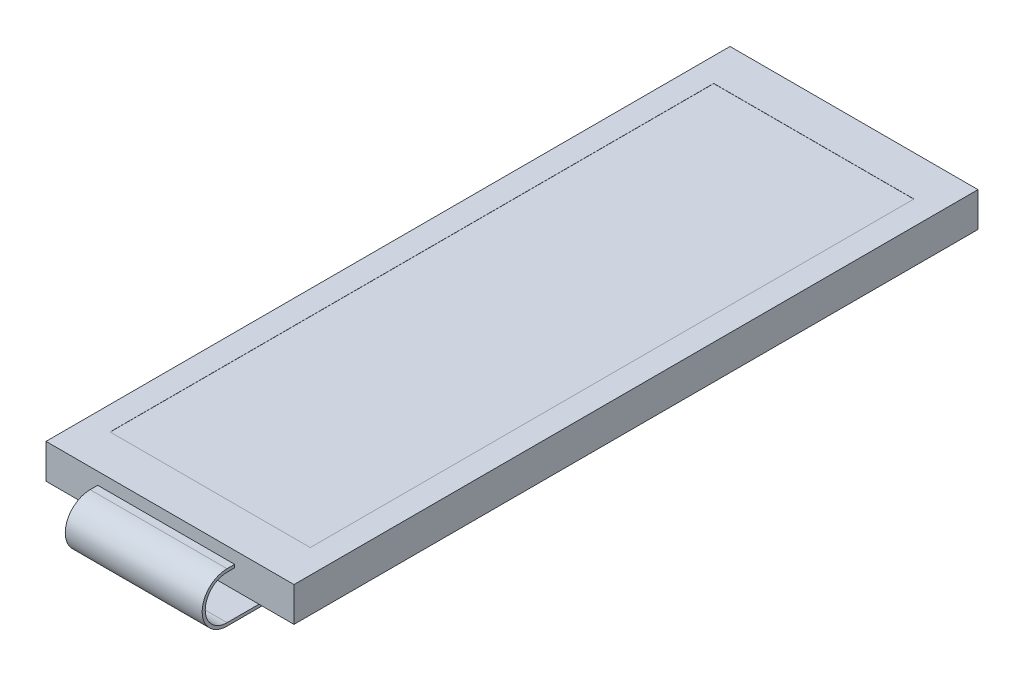
from build123d import *

# Parameters (mm, degrees)
SKETCH_1_W          = 16.3
SKETCH_1_H          = 44.96
EXTRUDE_1_DEPTH     = 2.27
SKETCH_2_W          = 13.16
SKETCH_2_H          = 39.68
CUT_EXTRUDE_1_DEPTH = 0.01
SKETCH_3_W          = 9
SKETCH_3_H          = 0.5
EXTRUDE_2_DEPTH     = 0.2
EXTRUDE_3_DEPTH     = 9
SKETCH_5_W          = 12.4
SKETCH_5_H          = 5.1
EXTRUDE_4_DEPTH     = 0.2
SKETCH_6_W          = 0.35
SKETCH_6_H          = 2
CUT_EXTRUDE_2_DEPTH = 0.05
FILLET_2_R          = 0.5


with BuildPart() as part:
    # 草图1 → 凸台-拉伸1 (new body)
    with BuildSketch(Plane(origin=(0, 0, 0), x_dir=(1, 0, 0), z_dir=(0, 1, 0))):
        Rectangle(SKETCH_1_W, SKETCH_1_H)
    extrude(amount=EXTRUDE_1_DEPTH)

    # 草图2 → 切除-拉伸1 (cut)
    with BuildSketch(Plane(origin=(0, 2.27, 0), x_dir=(1, 0, 0), z_dir=(0, 1, 0))):
        Rectangle(SKETCH_2_W, SKETCH_2_H)
    extrude(amount=-CUT_EXTRUDE_1_DEPTH, mode=Mode.SUBTRACT)

    # 草图3 → 凸台-拉伸2 (add)
    with BuildSketch(Plane(origin=(0, 1.27, 0), x_dir=(1, 0, 0), z_dir=(0, 1, 0))):
        with Locations((-0.25, -22.73)):
            Rectangle(SKETCH_3_W, SKETCH_3_H)
    extrude(amount=EXTRUDE_2_DEPTH)

    # 草图4 → 凸台-拉伸3 (add)
    with BuildSketch(Plane(origin=(4.25, 0, 0), x_dir=(0, 0, -1), z_dir=(1, 0, 0))):
        with BuildLine():
            Line((-22.73, 1.47), (-22.98, 1.47))
            ThreePointArc((-22.98, 1.47), (-24.615, -0.165), (-22.98, -1.8))
            Line((-22.98, -1.8), (-10.48, -1.8))
            Line((-10.48, -1.8), (-10.48, -1.6))
            Line((-10.48, -1.6), (-22.98, -1.6))
            ThreePointArc((-22.98, -1.6), (-24.415, -0.165), (-22.98, 1.27))
            Line((-22.98, 1.27), (-22.73, 1.27))
            Line((-22.73, 1.27), (-22.73, 1.47))
        make_face()
    extrude(amount=-EXTRUDE_3_DEPTH)

    # 草图5 → 凸台-拉伸4 (add)
    with BuildSketch(Plane.XZ.offset(1.8)):
        with Locations((-0.25, 13.03)):
            Rectangle(SKETCH_5_W, SKETCH_5_H)
    extrude(amount=-EXTRUDE_4_DEPTH)

    # 草图6 → 切除-拉伸2 (cut)
    with BuildSketch(Plane.XZ.offset(1.8)):
        with Locations((-4.45, 11.48)):
            Rectangle(SKETCH_6_W, SKETCH_6_H)
        with Locations((-3.75, 11.48)):
            Rectangle(SKETCH_6_W, SKETCH_6_H)
        with Locations((-3.05, 11.48)):
            Rectangle(SKETCH_6_W, SKETCH_6_H)
        with Locations((-2.35, 11.48)):
            Rectangle(SKETCH_6_W, SKETCH_6_H)
        with Locations((-1.65, 11.48)):
            Rectangle(SKETCH_6_W, SKETCH_6_H)
        with Locations((-0.95, 11.48)):
            Rectangle(SKETCH_6_W, SKETCH_6_H)
        with Locations((-0.25, 11.48)):
            Rectangle(SKETCH_6_W, SKETCH_6_H)
        with Locations((0.45, 11.48)):
            Rectangle(SKETCH_6_W, SKETCH_6_H)
        with Locations((1.15, 11.48)):
            Rectangle(SKETCH_6_W, SKETCH_6_H)
        with Locations((1.85, 11.48)):
            Rectangle(SKETCH_6_W, SKETCH_6_H)
        with Locations((2.55, 11.48)):
            Rectangle(SKETCH_6_W, SKETCH_6_H)
        with Locations((3.25, 11.48)):
            Rectangle(SKETCH_6_W, SKETCH_6_H)
        with Locations((3.95, 11.48)):
            Rectangle(SKETCH_6_W, SKETCH_6_H)
    extrude(amount=-CUT_EXTRUDE_2_DEPTH, mode=Mode.SUBTRACT)

    # 圆角2
    fillet_2_edges = [part.edges().sort_by_distance(p)[0] for p in [
        (-6.45, -1.7, 15.58),
        (5.95, -1.7, 10.48),
        (-4.75, -1.7, 15.58),
        (4.25, -1.7, 15.58),
        (-6.45, -1.7, 10.48),
        (5.95, -1.7, 15.58),
    ]]
    fillet(fillet_2_edges, radius=FILLET_2_R)


solid = part.part
